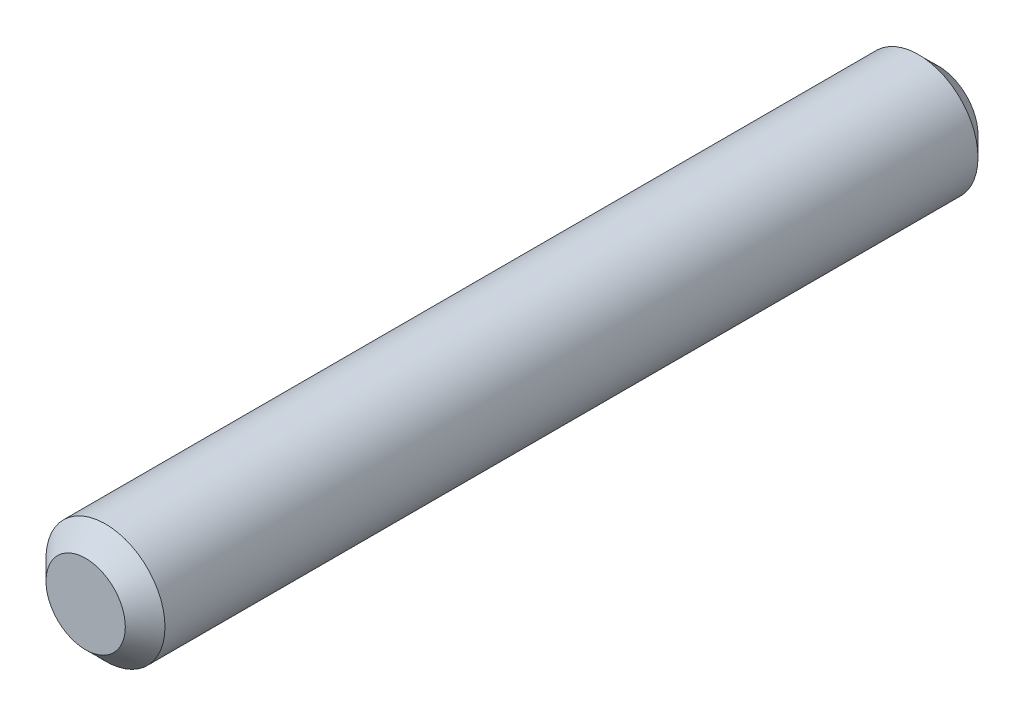
from build123d import *

# Parameters (mm, degrees)
SKETCH1_R           = 3
BOSS_EXTRUDE1_DEPTH = 43
CHAMFER1_SIZE       = 1


with BuildPart() as part:
    # Sketch1 → Boss-Extrude1 (new body)
    with BuildSketch(Plane(origin=(0, 0, 0), x_dir=(0, 1, 0), z_dir=(0, 0, 1))):
        with Locations(Location((0, 0, 0), (0, 0, 270))):
            Circle(SKETCH1_R)
    extrude(amount=BOSS_EXTRUDE1_DEPTH)

    # Chamfer1
    chamfer1_edges = [part.edges().sort_by_distance(p)[0] for p in [
        (-3, 0, 0),
        (-3, 0, 43),
    ]]
    chamfer(chamfer1_edges, length=CHAMFER1_SIZE)


solid = part.part
